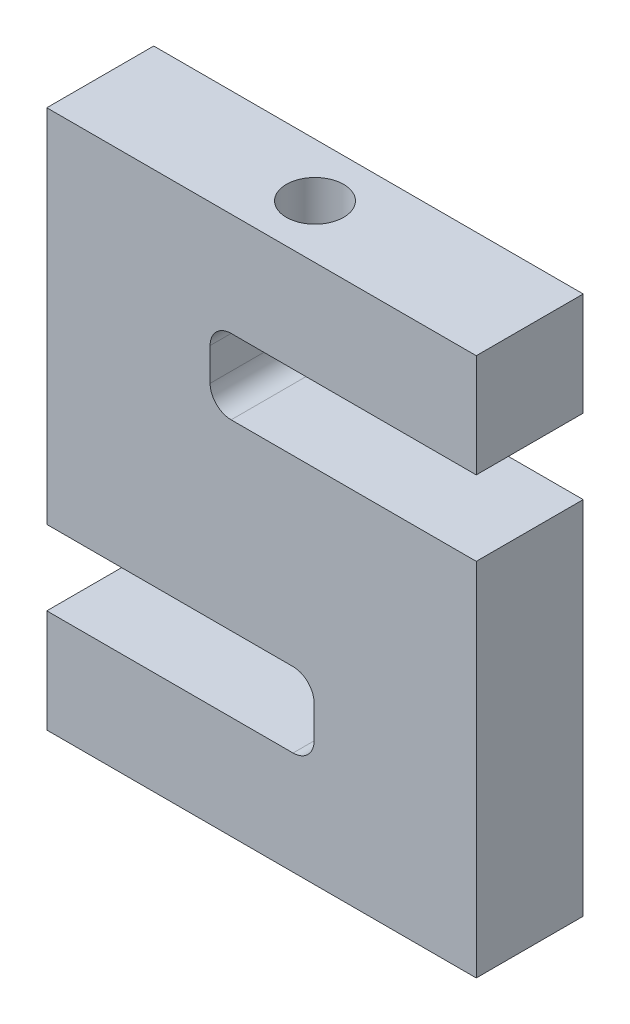
from build123d import *

# Parameters (mm, degrees)
BOSS_EXTRUDE1_DEPTH        = 12.7
M8X1_25_TAPPED_HOLE1_D     = 6.8
M8X1_25_TAPPED_HOLE1_DEPTH = 9.147932364
M8X1_25_TAPPED_HOLE1_TIP   = 2.042926105
M8X1_25_TAPPED_HOLE2_D     = 6.8
M8X1_25_TAPPED_HOLE2_DEPTH = 9.147932364
M8X1_25_TAPPED_HOLE2_TIP   = 2.042926105
FILLET3_R                  = 2.5
FILLET5_R                  = 2.5
FILLET6_R                  = 2.5
FILLET7_R                  = 2.5


with BuildPart() as part:
    # Sketch1 → Boss-Extrude1 (new body)
    with BuildSketch(Plane.XY):
        Polygon((25.5, 32), (25.5, 19.738981448), (-6.106181157, 19.738981448), (-6.106181157, 10.852067636), (25.5, 10.852067636), (25.5, -32), (-25.5, -32), (-25.5, -19.738981448), (6.242414697, -19.738981448), (6.242414697, -10.852067636), (-25.5, -10.852067636), (-25.5, 32), align=None)
    extrude(amount=BOSS_EXTRUDE1_DEPTH)

    # M8x1.25 Tapped Hole1
    with Locations(Plane(origin=(0, 32, 0), x_dir=(1, 0, 0), z_dir=(0, 1, 0))):
        with Locations((0, -6.35)):
            Hole(M8X1_25_TAPPED_HOLE1_D / 2, depth=M8X1_25_TAPPED_HOLE1_DEPTH)
            with Locations((0, 0, -(M8X1_25_TAPPED_HOLE1_DEPTH + M8X1_25_TAPPED_HOLE1_TIP / 2))):  # 118° drill point
                Cone(0, M8X1_25_TAPPED_HOLE1_D / 2, M8X1_25_TAPPED_HOLE1_TIP, mode=Mode.SUBTRACT)

    # M8x1.25 Tapped Hole2
    with Locations(Plane(origin=(0, -32, 0), x_dir=(-1, 0, 0), z_dir=(0, -1, 0))):
        with Locations((0, -6.35)):
            Hole(M8X1_25_TAPPED_HOLE2_D / 2, depth=M8X1_25_TAPPED_HOLE2_DEPTH)
            with Locations((0, 0, -(M8X1_25_TAPPED_HOLE2_DEPTH + M8X1_25_TAPPED_HOLE2_TIP / 2))):  # 118° drill point
                Cone(0, M8X1_25_TAPPED_HOLE2_D / 2, M8X1_25_TAPPED_HOLE2_TIP, mode=Mode.SUBTRACT)

    # Fillet3
    fillet3_edges = [part.edges().sort_by_distance(p)[0] for p in [
        (-6.106181157, 19.738981448, 6.35),
    ]]
    fillet(fillet3_edges, radius=FILLET3_R)

    # Fillet5
    fillet5_edges = [part.edges().sort_by_distance(p)[0] for p in [
        (-6.106181157, 10.852067636, 6.35),
    ]]
    fillet(fillet5_edges, radius=FILLET5_R)

    # Fillet6
    fillet6_edges = [part.edges().sort_by_distance(p)[0] for p in [
        (6.242414697, -10.852067636, 6.35),
    ]]
    fillet(fillet6_edges, radius=FILLET6_R)

    # Fillet7
    fillet7_edges = [part.edges().sort_by_distance(p)[0] for p in [
        (6.242414697, -19.738981448, 6.35),
    ]]
    fillet(fillet7_edges, radius=FILLET7_R)


solid = part.part
